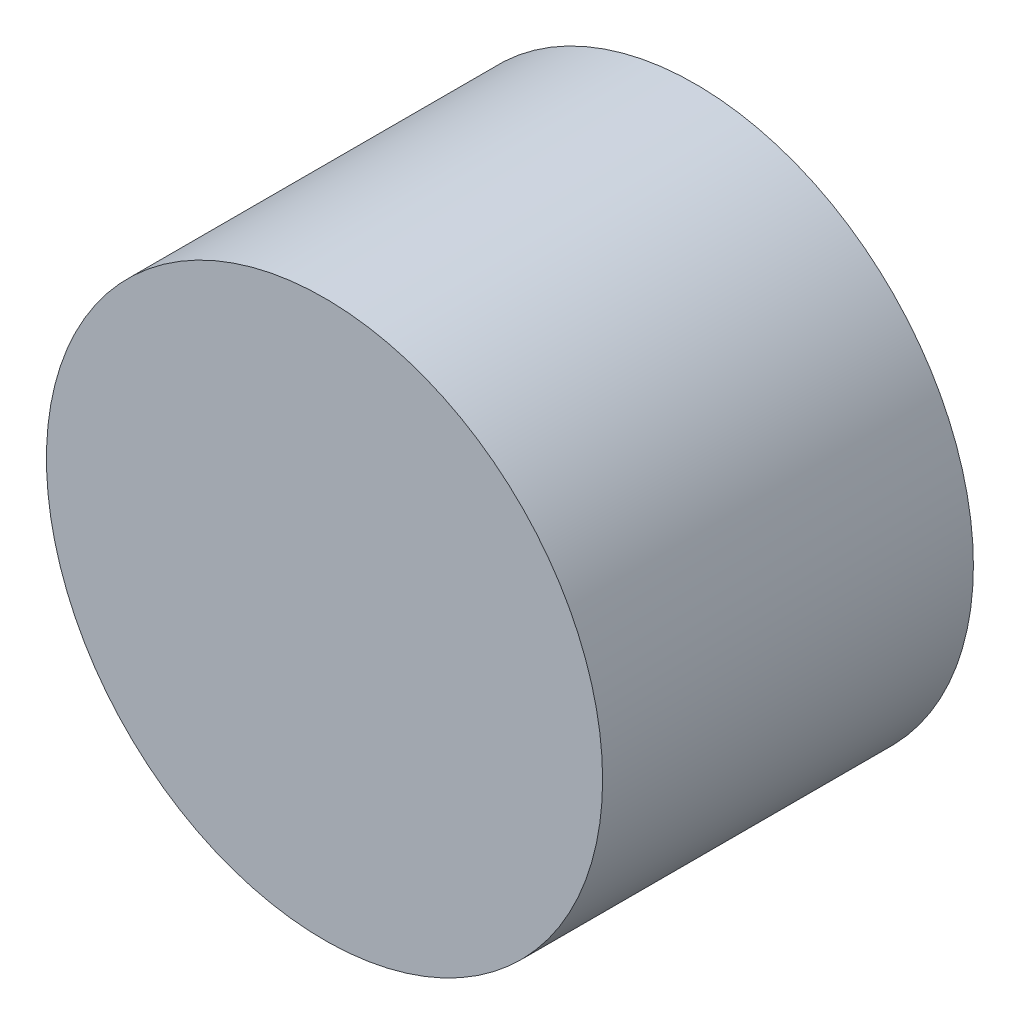
from build123d import *

# Parameters (mm, degrees)
SKETCH_1_R      = 3.75
EXTRUDE_1_DEPTH = 5


with BuildPart() as part:
    # 草图1 → 凸台-拉伸1 (new body)
    with BuildSketch(Plane.XY):
        Circle(SKETCH_1_R)
    extrude(amount=EXTRUDE_1_DEPTH)


solid = part.part
